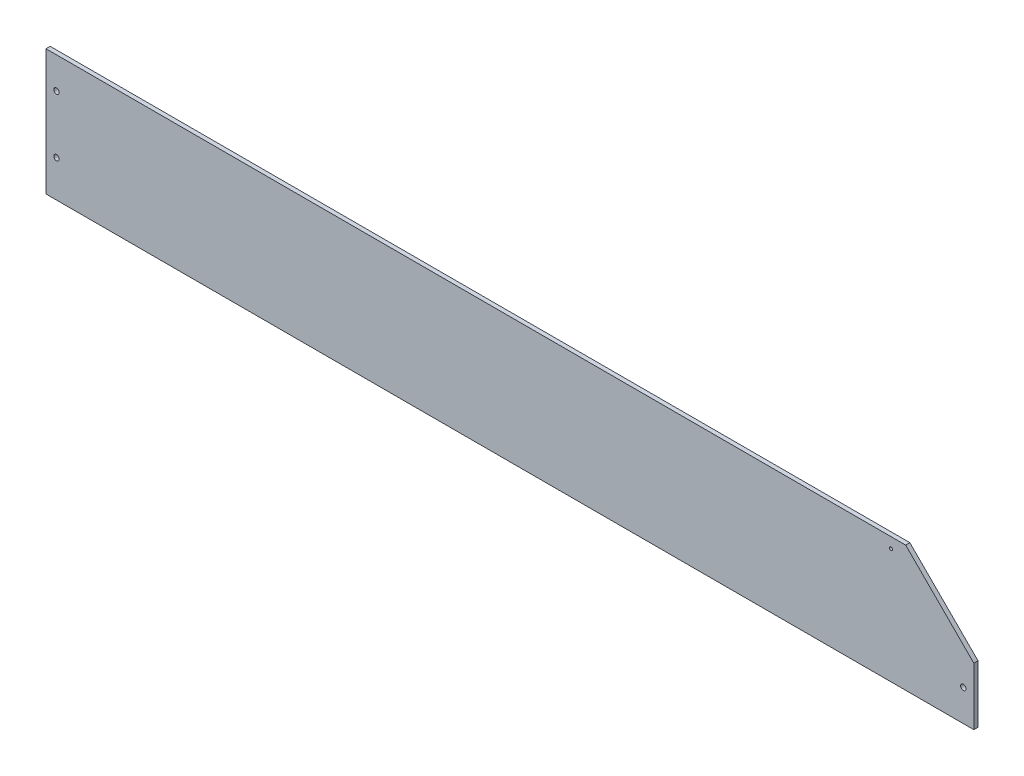
from build123d import *

# Parameters (mm, degrees)
BOSS_EXTRUDE1_DEPTH = 4
SKETCH8_R           = 2.6
CUT_EXTRUDE4_DEPTH  = 10
SKETCH9_R           = 2.6
CUT_EXTRUDE5_DEPTH  = 10
SKETCH10_R          = 1.5
CUT_EXTRUDE6_DEPTH  = 894.10749633


with BuildPart() as part:
    # Sketch1 → Boss-Extrude1 (new body)
    with BuildSketch(Plane.XY):
        Polygon((0, 0), (885, 0), (885, 55), (820, 120), (0, 120), align=None)
    extrude(amount=BOSS_EXTRUDE1_DEPTH)


with BuildPart() as part_1:
    # Body-Move/Copy1: moved
    add(part.part.moved(Location((0, 0, -4))))

    # Sketch8 → Cut-Extrude4 (cut)
    with BuildSketch(Plane.XY):
        with Locations((10, 90)):
            Circle(SKETCH8_R)
        with Locations((10, 35)):
            Circle(SKETCH8_R)
    extrude(amount=-CUT_EXTRUDE4_DEPTH, mode=Mode.SUBTRACT)

    # Sketch9 → Cut-Extrude5 (cut)
    with BuildSketch(Plane.XY):
        with Locations((875, 30)):
            Circle(SKETCH9_R)
    extrude(amount=-CUT_EXTRUDE5_DEPTH, mode=Mode.SUBTRACT)

    # Sketch10 → Cut-Extrude6 (cut, through all)
    with BuildSketch(Plane.XY):
        with Locations((806, 110)):
            Circle(SKETCH10_R)
    extrude(amount=-CUT_EXTRUDE6_DEPTH, mode=Mode.SUBTRACT)


solid = part_1.part
